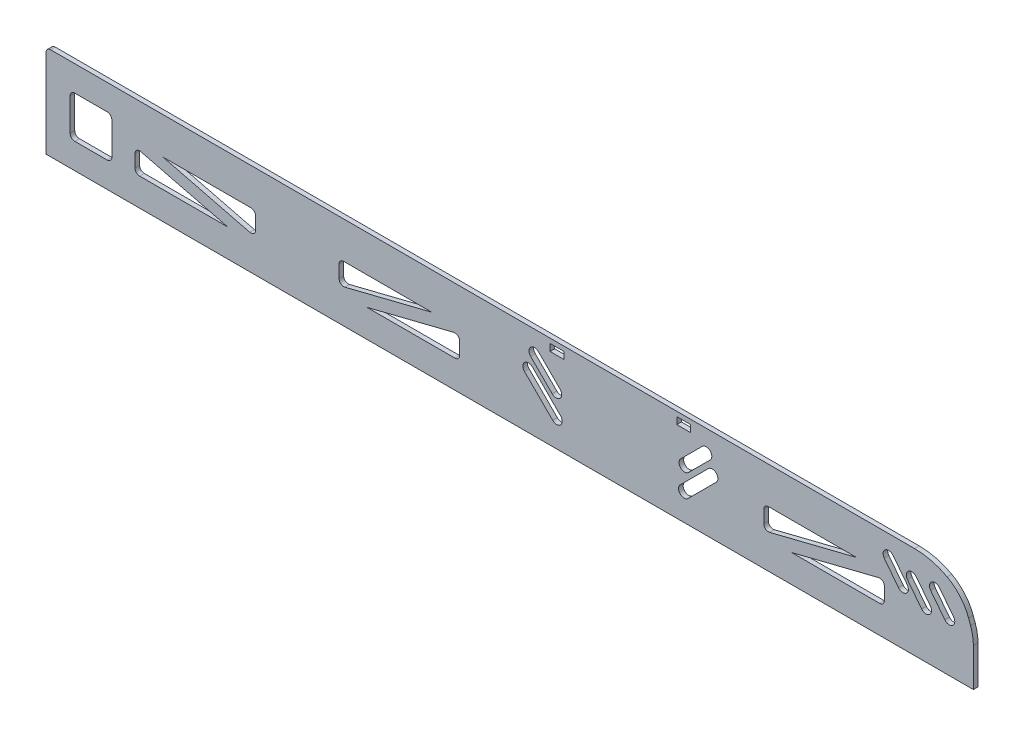
from build123d import *

# Parameters (mm, degrees)
SKETCH1_W           = 9
SKETCH1_H           = 9
SKETCH1_W_2         = 3
SKETCH1_H_2         = 1.5
BOSS_EXTRUDE1_DEPTH = 0.5
FILLET1_R           = 10
FILLET3_R           = 1


with BuildPart() as part:
    # Sketch1 → Boss-Extrude1 (new, symmetric)
    with BuildSketch(Plane.XY):
        with BuildLine():
            Line((-200, 10), (-200, 20))
            Line((-200, 20), (-12.686273665, 20))
            ThreePointArc((-12.686273665, 20), (-6.83279553, 18.787212337), (-1.943060243, 15.348528137))
            Line((-1.943060243, 15.348528137), (0, 10))
            Line((0, 10), (0, 0))
            Line((0, 0), (-10, 0))
            Line((-10, 0), (-200, 0))
            Line((-200, 0), (-200, 10))
        make_face()
        Polygon((-180.8, 11), (-180.8, 6), (-160.8, 6), align=None, mode=Mode.SUBTRACT)
        with Locations((-190.3, 10)):
            Rectangle(SKETCH1_W, SKETCH1_H, mode=Mode.SUBTRACT)
        Polygon((-154.8, 7.076941016), (-154.8, 12.076941016), (-174.8, 12.076941016), align=None, mode=Mode.SUBTRACT)
        Polygon((-130.8, 6), (-110.8, 11), (-110.8, 6), align=None, mode=Mode.SUBTRACT)
        Polygon((-136.8, 7.076941016), (-136.8, 12.076941016), (-116.8, 12.076941016), align=None, mode=Mode.SUBTRACT)
        with BuildLine():
            Line((-95.102943725, 12.697056275), (-89.021825407, 6.615937957))
            ThreePointArc((-89.021825407, 6.615937957), (-89.021825407, 4.918881682), (-90.718881682, 4.918881682))
            Line((-90.718881682, 4.918881682), (-96.8, 11))
            ThreePointArc((-96.8, 11), (-96.8, 12.697056275), (-95.102943725, 12.697056275))
        make_face(mode=Mode.SUBTRACT)
        with BuildLine():
            Line((-93.794617613, 16.197056275), (-89.127712857, 11.530151519))
            ThreePointArc((-89.127712857, 11.530151519), (-89.127712857, 9.833095244), (-90.824769132, 9.833095244))
            Line((-90.824769132, 9.833095244), (-95.491673888, 14.5))
            ThreePointArc((-95.491673888, 14.5), (-95.491673888, 16.197056275), (-93.794617613, 16.197056275))
        make_face(mode=Mode.SUBTRACT)
        with Locations((-89.794617613, 18.25)):
            Rectangle(SKETCH1_W_2, SKETCH1_H_2, mode=Mode.SUBTRACT)
        with Locations((-62.460808101, 18.25)):
            Rectangle(SKETCH1_W_2, SKETCH1_H_2, mode=Mode.SUBTRACT)
        with BuildLine():
            Line((-58.460808101, 16.197056275), (-63.127712857, 11.530151519))
            ThreePointArc((-63.127712857, 11.530151519), (-63.127712857, 9.833095244), (-61.430656582, 9.833095244))
            Line((-61.430656582, 9.833095244), (-56.763751827, 14.5))
            ThreePointArc((-56.763751827, 14.5), (-56.763751827, 16.197056275), (-58.460808101, 16.197056275))
        make_face(mode=Mode.SUBTRACT)
        with BuildLine():
            Line((-57.152481989, 12.697056275), (-63.233600308, 6.615937957))
            ThreePointArc((-63.233600308, 6.615937957), (-63.233600308, 4.918881682), (-61.536544033, 4.918881682))
            Line((-61.536544033, 4.918881682), (-55.455425715, 11))
            ThreePointArc((-55.455425715, 11), (-55.455425715, 12.697056275), (-57.152481989, 12.697056275))
        make_face(mode=Mode.SUBTRACT)
        Polygon((-25.2, 12.076941016), (-45.2, 7.076941016), (-45.2, 12.076941016), align=None, mode=Mode.SUBTRACT)
        Polygon((-39.2, 6), (-19.2, 11), (-19.2, 6), align=None, mode=Mode.SUBTRACT)
        with BuildLine():
            Line((-17.321963125, 16.390064684), (-14.260022427, 12.437278431))
            ThreePointArc((-14.260022427, 12.437278431), (-14.47382536, 10.753743963), (-16.157359828, 10.967546896))
            Line((-16.157359828, 10.967546896), (-19.219300527, 14.920333149))
            ThreePointArc((-19.219300527, 14.920333149), (-19.005497594, 16.603867617), (-17.321963125, 16.390064684))
        make_face(mode=Mode.SUBTRACT)
        with BuildLine():
            Line((-12.321963125, 14.907009966), (-9.260022427, 10.954223713))
            ThreePointArc((-9.260022427, 10.954223713), (-9.47382536, 9.270689245), (-11.157359828, 9.484492178))
            Line((-11.157359828, 9.484492178), (-14.219300527, 13.437278431))
            ThreePointArc((-14.219300527, 13.437278431), (-14.005497594, 15.120812899), (-12.321963125, 14.907009966))
        make_face(mode=Mode.SUBTRACT)
        with BuildLine():
            Line((-7.321963125, 15.376741501), (-4.260022427, 11.423955248))
            ThreePointArc((-4.260022427, 11.423955248), (-4.47382536, 9.74042078), (-6.157359828, 9.954223713))
            Line((-6.157359828, 9.954223713), (-9.219300527, 13.907009966))
            ThreePointArc((-9.219300527, 13.907009966), (-9.005497594, 15.590544434), (-7.321963125, 15.376741501))
        make_face(mode=Mode.SUBTRACT)
    extrude(amount=BOSS_EXTRUDE1_DEPTH, both=True)

    # Fillet1
    fillet1_edges = [part.edges().sort_by_distance(p)[0] for p in [
        (0, 10, 0),
        (-1.943060243, 15.348528137, 0),
    ]]
    fillet(fillet1_edges, radius=FILLET1_R)

    # Fillet3
    fillet3_edges = [part.edges().sort_by_distance(p)[0] for p in [
        (-200, 20, 0),
        (-154.8, 7.076941016, 0),
        (-154.8, 12.076941016, 0),
        (-180.8, 11, 0),
        (-180.8, 6, 0),
        (-194.8, 14.5, 0),
        (-194.8, 5.5, 0),
        (-185.8, 5.5, 0),
        (-185.8, 14.5, 0),
        (-110.8, 6, 0),
        (-110.8, 11, 0),
        (-136.8, 7.076941016, 0),
        (-136.8, 12.076941016, 0),
        (-45.2, 12.076941016, 0),
        (-45.2, 7.076941016, 0),
        (-19.2, 6, 0),
        (-19.2, 11, 0),
    ]]
    fillet(fillet3_edges, radius=FILLET3_R)


solid = part.part
